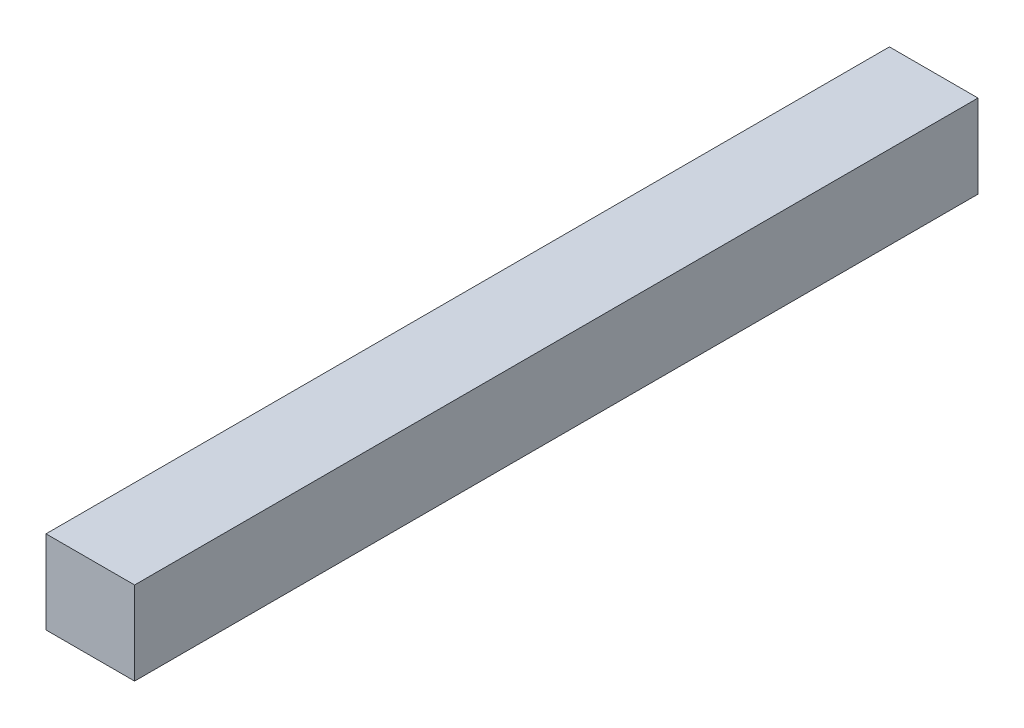
from build123d import *

# Parameters (mm, degrees)
SKETCH1_W           = 50
SKETCH1_H           = 47
BOSS_EXTRUDE1_DEPTH = 476


with BuildPart() as part:
    # Sketch1 → Boss-Extrude1 (new body)
    with BuildSketch(Plane.XY):
        with Locations((-2658.714285714, 1679.071428571)):
            Rectangle(SKETCH1_W, SKETCH1_H)
    extrude(amount=BOSS_EXTRUDE1_DEPTH)


solid = part.part
